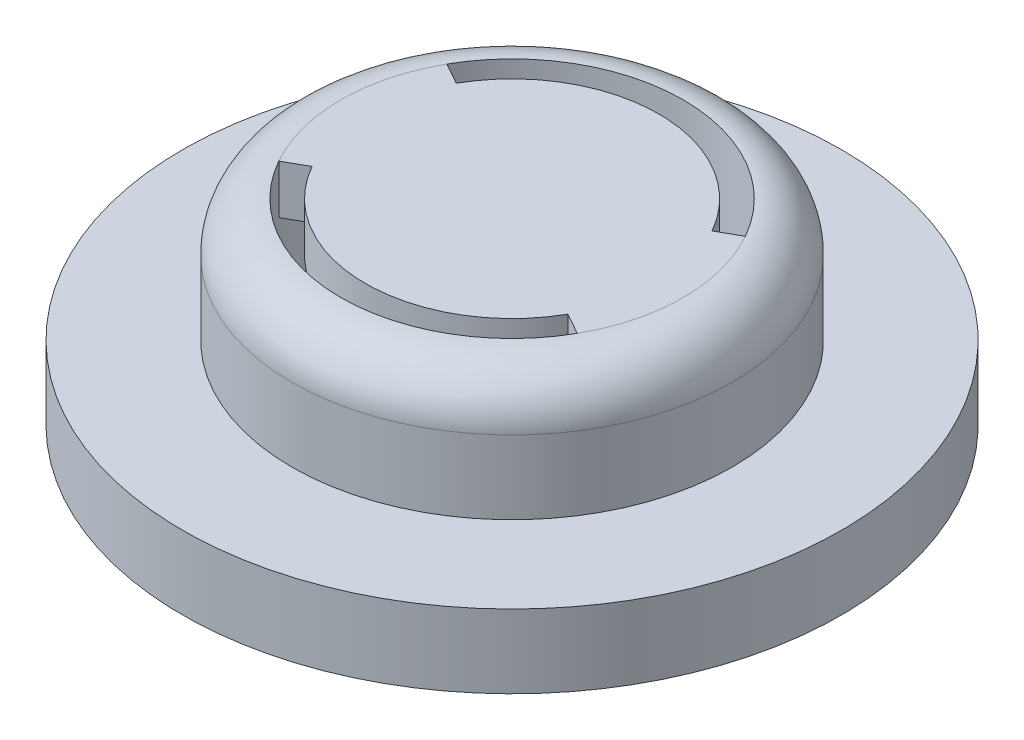
from build123d import *
from build123d.topology import SkipClean

# Parameters (mm, degrees)
SKETCH1_R           = 9
BOSS_EXTRUDE1_DEPTH = 5
SKETCH2_R           = 13.469028944
BOSS_EXTRUDE2_DEPTH = 3
SHELL1_T            = -2
FILLET1_R           = 2
CUT_EXTRUDE1_START  = -13
CUT_EXTRUDE1_DEPTH  = 13


with BuildPart() as part:
    # Sketch1 → Boss-Extrude1 (new body)
    with BuildSketch(Plane(origin=(0, 0, 0), x_dir=(1, 0, 0), z_dir=(0, 1, 0))):
        with Locations(Location((0, 0, 0), (0, 0, 270))):
            Circle(SKETCH1_R)
    extrude(amount=BOSS_EXTRUDE1_DEPTH)

    # Sketch2 → Boss-Extrude2 (add)
    with BuildSketch(Plane.XZ):
        with Locations(Location((0, 0, 0), (0, 0, 270))):
            Circle(SKETCH2_R)
    extrude(amount=BOSS_EXTRUDE2_DEPTH)

    # Shell1
    shell1_openings = [part.faces().sort_by_distance(p)[0] for p in [
        (0, -3, 0),
    ]]
    offset(amount=SHELL1_T, openings=shell1_openings, kind=Kind.INTERSECTION)

    # Fillet1
    fillet1_edges = [part.edges().sort_by_distance(p)[0] for p in [
        (0, 5, -9),
    ]]
    fillet(fillet1_edges, radius=FILLET1_R)

    # Sketch3 → Cut-Extrude1 (cut)
    with SkipClean():  # the faces are left unmerged after this step: merging them gives an invalid solid
        with BuildSketch(Plane(origin=(0, 5, 0), x_dir=(1, 0, 0), z_dir=(0, 1, 0)).offset(CUT_EXTRUDE1_START)):
            with BuildLine():
                Line((5.227613876, -2.944834998), (6.098882855, -3.435640831))
                ThreePointArc((6.098882855, -3.435640831), (0, -7), (-6.098882855, -3.435640831))
                Line((-6.098882855, -3.435640831), (-5.227613876, -2.944834998))
                ThreePointArc((-5.227613876, -2.944834998), (0, -6), (5.227613876, -2.944834998))
            make_face()
            with BuildLine():
                Line((5.227613876, 2.944834998), (6.098882855, 3.435640831))
                ThreePointArc((6.098882855, 3.435640831), (0, 7), (-6.098882855, 3.435640831))
                Line((-6.098882855, 3.435640831), (-5.227613876, 2.944834998))
                ThreePointArc((-5.227613876, 2.944834998), (0, 6), (5.227613876, 2.944834998))
            make_face()
        extrude(amount=CUT_EXTRUDE1_DEPTH, mode=Mode.SUBTRACT)


solid = part.part
